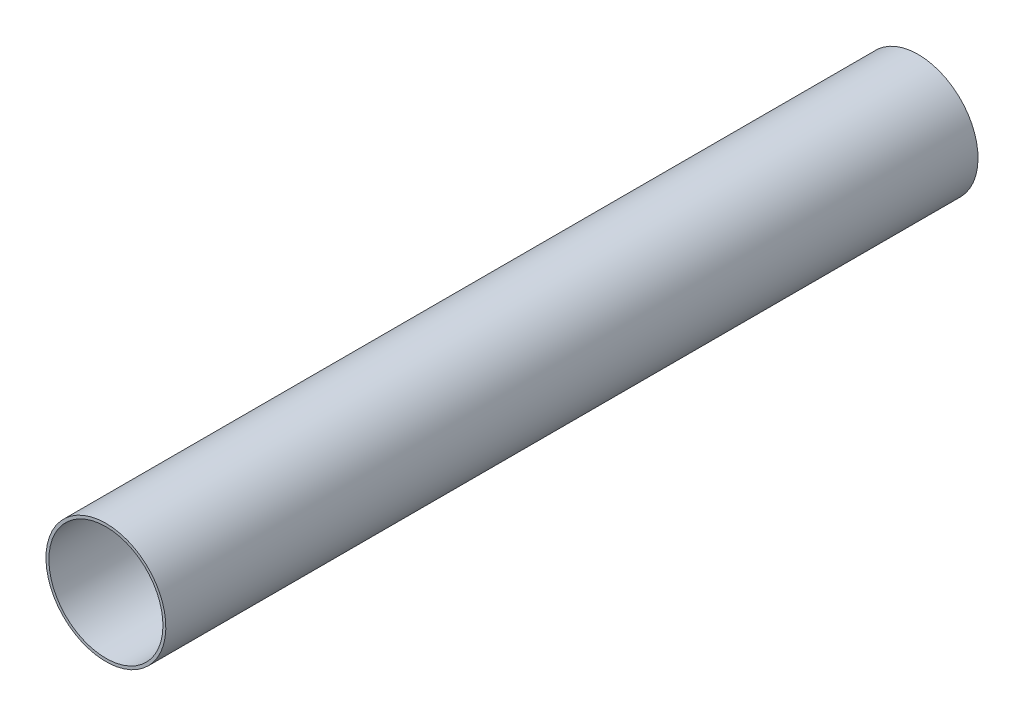
from build123d import *

# Parameters (mm, degrees)
ESQUISSE2_W = 700
ESQUISSE2_H = 2.5


with BuildPart() as part:
    # Esquisse2 → Révolution1 (revolve)
    with BuildSketch(Plane(origin=(0, 0, 0), x_dir=(0, 0, -1), z_dir=(1, 0, 0))):
        with Locations((-360, 50.399)):
            Rectangle(ESQUISSE2_W, ESQUISSE2_H)
    revolve(axis=Axis((0, 0, 0), (0, 0, 1)))


solid = part.part
